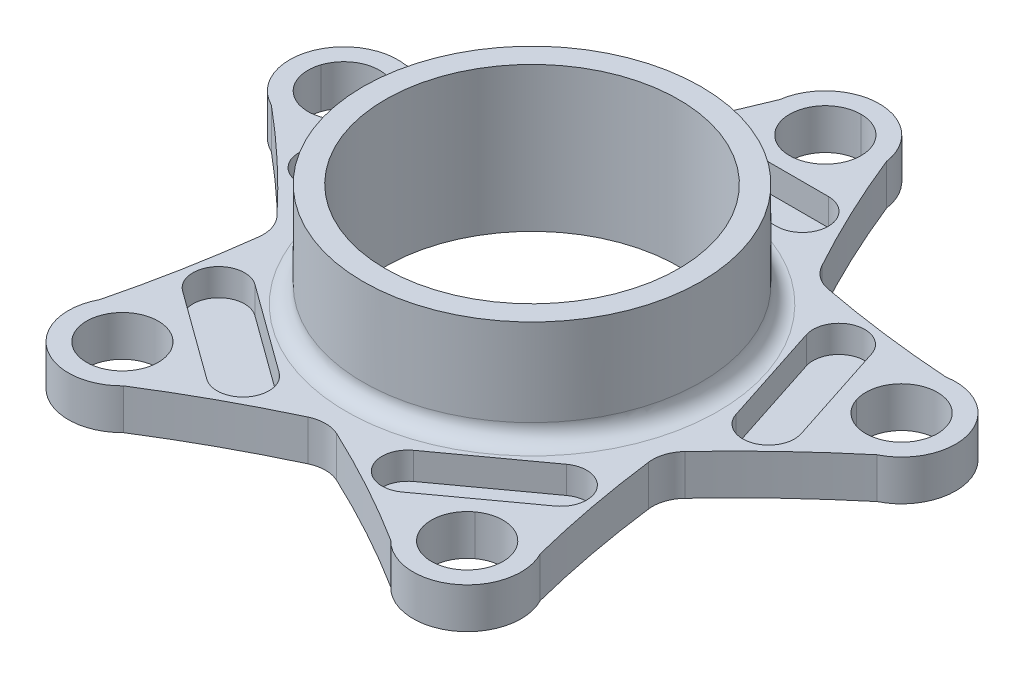
from build123d import *

# Parameters (mm, degrees)
SKETCH1_R                 = 31.75
CENTERCIRCLEEXTRUDE_DEPTH = 19.558
SKETCH2_R                 = 80.01
BASEEXPAND_DEPTH          = 7.62
FILLET15_R                = 3.175
SKETCH3_R                 = 27.559
CENTERCUT_DEPTH           = 27.178
SKETCH4_R                 = 6.731
OUTERCIRCLECUT_DEPTH      = 7.62
SKETCH8_R                 = 80.01
STARFISHCUT_DEPTH         = 7.62
BATMAN_CUT_DEPTH          = 5.08
FILLET12_R                = 6.35


with BuildPart() as part:
    # Sketch1 → CenterCircleExtrude (new body)
    with BuildSketch(Plane(origin=(0, 0, 0), x_dir=(1, 0, 0), z_dir=(0, 1, 0))):
        Circle(SKETCH1_R)
    extrude(amount=CENTERCIRCLEEXTRUDE_DEPTH)

    # Sketch2 → BaseExpand (add)
    with BuildSketch(Plane.XZ):
        Circle(SKETCH2_R)
    extrude(amount=BASEEXPAND_DEPTH)

    # Fillet15
    fillet15_edges = [part.edges().sort_by_distance(p)[0] for p in [
        (-31.75, 0, 0),
    ]]
    fillet(fillet15_edges, radius=FILLET15_R)

    # Sketch3 → CenterCut (cut)
    with BuildSketch(Plane(origin=(0, 19.558, 0), x_dir=(1, 0, 0), z_dir=(0, 1, 0))):
        Circle(SKETCH3_R)
    extrude(amount=-CENTERCUT_DEPTH, mode=Mode.SUBTRACT)

    # Sketch4 → OuterCircleCut (cut)
    with BuildSketch(Plane(origin=(0, 0, 0), x_dir=(1, 0, 0), z_dir=(0, 1, 0))):
        with Locations((0, 55.118)):
            Circle(SKETCH4_R)
        with Locations((52.420333065, 17.032398696)):
            Circle(SKETCH4_R)
        with Locations((32.397547536, -44.591398696)):
            Circle(SKETCH4_R)
        with Locations((-32.397547536, -44.591398696)):
            Circle(SKETCH4_R)
        with Locations((-52.420333065, 17.032398696)):
            Circle(SKETCH4_R)
    extrude(amount=-OUTERCIRCLECUT_DEPTH, mode=Mode.SUBTRACT)

    # Sketch8 → StarfishCut (cut)
    with BuildSketch(Plane(origin=(0, 0, 0), x_dir=(1, 0, 0), z_dir=(0, 1, 0))):
        Circle(SKETCH8_R)
        with BuildLine():
            ThreePointArc((-60.451485692, 10.809361858), (-62.083067271, 20.172011359), (-55.259862746, 26.787534327))
            ThreePointArc((-55.259862746, 26.787534327), (-52.990125634, 27.176408575), (-50.691117004, 27.044162367))
            ThreePointArc((-50.691117004, 27.044162367), (-36.498445494, 28.482280038), (-22.436174146, 30.88074446))
            ThreePointArc((-22.436174146, 30.88074446), (-15.809618103, 43.513592992), (-10.056110229, 56.567222915))
            ThreePointArc((-10.056110229, 56.567222915), (-9.47145111, 58.794576379), (-8.400222382, 60.833055899))
            ThreePointArc((-8.400222382, 60.833055899), (0, 65.278), (8.400222382, 60.833055899))
            ThreePointArc((8.400222382, 60.833055899), (9.47145111, 58.794576379), (10.056110229, 56.567222915))
            ThreePointArc((10.056110229, 56.567222915), (15.809618103, 43.513592992), (22.436174146, 30.88074446))
            ThreePointArc((22.436174146, 30.88074446), (36.498445494, 28.482280038), (50.691117004, 27.044162367))
            ThreePointArc((50.691117004, 27.044162367), (52.990125634, 27.176408575), (55.259862746, 26.787534327))
            ThreePointArc((55.259862746, 26.787534327), (60.546685924, 23.130594267), (62.580333065, 17.032398696))
            ThreePointArc((62.580333065, 17.032398696), (62.033399971, 13.743851196), (60.451485692, 10.809361858))
            ThreePointArc((60.451485692, 10.809361858), (58.843804343, 9.160637981), (56.90613492, 7.916304043))
            ThreePointArc((56.90613492, 7.916304043), (46.26932683, -1.589400596), (36.302492346, -11.795394786))
            ThreePointArc((36.302492346, -11.795394786), (38.366897955, -25.910575851), (41.384943465, -39.853011375))
            ThreePointArc((41.384943465, -39.853011375), (42.22114982, -41.998632188), (42.552695773, -44.27744921))
            ThreePointArc((42.552695773, -44.27744921), (42.556334523, -44.434405209), (42.557547536, -44.591398696))
            ThreePointArc((42.557547536, -44.591398696), (38.241722309, -52.902308467), (28.960850446, -54.152502874))
            ThreePointArc((28.960850446, -54.152502874), (26.896020001, -53.132990748), (25.11381532, -51.674677951))
            ThreePointArc((25.11381532, -51.674677951), (12.786398515, -44.495896582), (0, -38.170699348))
            ThreePointArc((0, -38.170699348), (-12.786398515, -44.495896582), (-25.11381532, -51.674677951))
            ThreePointArc((-25.11381532, -51.674677951), (-26.896020001, -53.132990748), (-28.960850446, -54.152502874))
            ThreePointArc((-28.960850446, -54.152502874), (-38.369445699, -52.811011359), (-42.552695773, -44.27744921))
            ThreePointArc((-42.552695773, -44.27744921), (-42.22114982, -41.998632188), (-41.384943465, -39.853011375))
            ThreePointArc((-41.384943465, -39.853011375), (-38.366897955, -25.910575851), (-36.302492346, -11.795394786))
            ThreePointArc((-36.302492346, -11.795394786), (-46.26932683, -1.589400596), (-56.90613492, 7.916304043))
            ThreePointArc((-56.90613492, 7.916304043), (-58.843804343, 9.160637981), (-60.451485692, 10.809361858))
        make_face(mode=Mode.SUBTRACT)
    extrude(amount=-STARFISHCUT_DEPTH, mode=Mode.SUBTRACT)

    # Sketch14 → Batman Cut (cut)
    with BuildSketch(Plane(origin=(0, 0, 0), x_dir=(1, 0, 0), z_dir=(0, 1, 0))):
        with BuildLine():
            Line((-29.28146985, -22.804327102), (-12.639732086, -34.895257327))
            ThreePointArc((-12.639732086, -34.895257327), (-11.563303962, -41.691557027), (-18.359603662, -42.767985152))
            Line((-18.359603662, -42.767985152), (-35.001341426, -30.677054926))
            ThreePointArc((-35.001341426, -30.677054926), (-36.07776955, -23.880755226), (-29.28146985, -22.804327102))
        make_face()
        with BuildLine():
            Line((-30.736675694, 20.801408088), (-37.093253888, 1.237872028))
            ThreePointArc((-37.093253888, 1.237872028), (-43.224284421, -1.88604406), (-46.348200509, 4.244986472))
            Line((-46.348200509, 4.244986472), (-39.991622315, 23.808522532))
            ThreePointArc((-39.991622315, 23.808522532), (-33.860591782, 26.93243862), (-30.736675694, 20.801408088))
        make_face()
        with BuildLine():
            Line((10.28515957, 35.660304314), (-10.28515957, 35.660304314))
            ThreePointArc((-10.28515957, 35.660304314), (-15.150772949, 40.525917694), (-10.28515957, 45.391531073))
            Line((-10.28515957, 45.391531073), (10.28515957, 45.391531073))
            ThreePointArc((10.28515957, 45.391531073), (15.150772949, 40.525917694), (10.28515957, 35.660304314))
        make_face()
        with BuildLine():
            Line((37.093253888, 1.237872028), (30.736675694, 20.801408088))
            ThreePointArc((30.736675694, 20.801408088), (33.860591782, 26.93243862), (39.991622315, 23.808522532))
            Line((39.991622315, 23.808522532), (46.348200509, 4.244986472))
            ThreePointArc((46.348200509, 4.244986472), (43.224284421, -1.88604406), (37.093253888, 1.237872028))
        make_face()
        with BuildLine():
            Line((12.639732086, -34.895257327), (29.28146985, -22.804327102))
            ThreePointArc((29.28146985, -22.804327102), (36.07776955, -23.880755226), (35.001341426, -30.677054926))
            Line((35.001341426, -30.677054926), (18.359603662, -42.767985152))
            ThreePointArc((18.359603662, -42.767985152), (11.563303962, -41.691557027), (12.639732086, -34.895257327))
        make_face()
    extrude(amount=-BATMAN_CUT_DEPTH, mode=Mode.SUBTRACT)

    # Fillet12
    fillet12_edges = [part.edges().sort_by_distance(p)[0] for p in [
        (-36.302492346, -3.81, 11.795394786),
        (0, -3.81, 38.170699348),
        (36.302492346, -3.81, 11.795394786),
        (22.436174146, -3.81, -30.88074446),
        (-22.436174146, -3.81, -30.88074446),
    ]]
    fillet(fillet12_edges, radius=FILLET12_R)


solid = part.part
